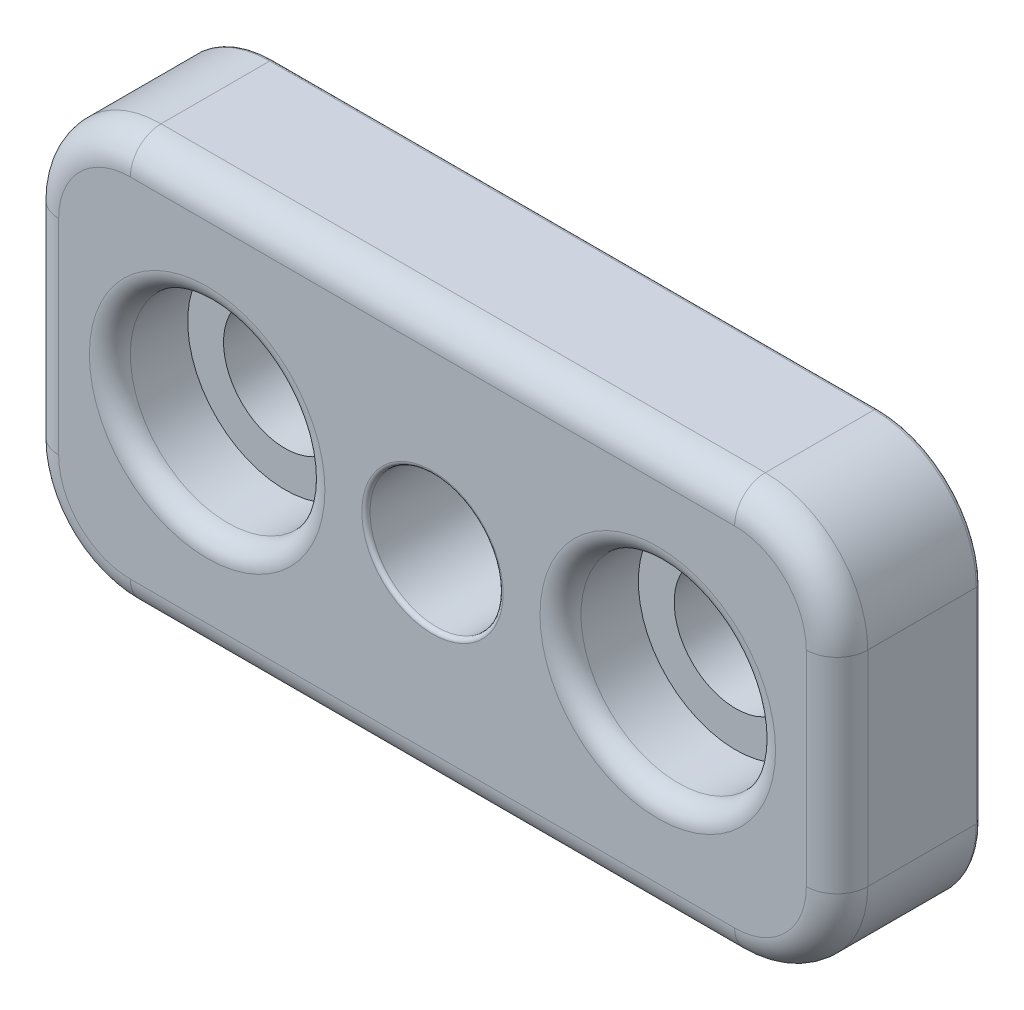
from build123d import *

# Parameters (mm, degrees)
SKETCH1_W           = 39.5
SKETCH1_H           = 20
SKETCH1_R           = 3.25
SKETCH1_R_2         = 4.75
SKETCH1_R_3         = 3
BOSS_EXTRUDE1_DEPTH = 3.5
CUT_EXTRUDE1_START  = -0.3
SKETCH1_3_R         = 4.75
SKETCH1_3_R_2       = 3
CUT_EXTRUDE1_DEPTH  = 3.8
FILLET1_R           = 5
FILLET2_R           = 1.5
FILLET3_R           = 1
FILLET4_R           = 0.2


with BuildPart() as part:
    # Sketch1 → Boss-Extrude1 (new, symmetric)
    # profile 1 of 3: a face of its own
    with BuildSketch(Plane.XY):
        Rectangle(SKETCH1_W, SKETCH1_H)
        Circle(SKETCH1_R, mode=Mode.SUBTRACT)
        with Locations((-11, 0)):
            Circle(SKETCH1_R_2, mode=Mode.SUBTRACT)
        with Locations((11, 0)):
            Circle(SKETCH1_R_2, mode=Mode.SUBTRACT)
    # profile 2 of 3: a face of its own
    with BuildSketch(Plane.XY):
        with Locations((-11, 0)):
            Circle(SKETCH1_R_2)
        with Locations((-11, 0)):
            Circle(SKETCH1_R_3, mode=Mode.SUBTRACT)
    # profile 3 of 3: a face of its own
    with BuildSketch(Plane.XY):
        with Locations((11, 0)):
            Circle(SKETCH1_R_2)
        with Locations((11, 0)):
            Circle(SKETCH1_R_3, mode=Mode.SUBTRACT)
    extrude(amount=BOSS_EXTRUDE1_DEPTH, both=True)

    # Sketch1<3> → Cut-Extrude1 (cut)
    # profile 1 of 2: a face of its own
    with BuildSketch(Plane.XY.offset(CUT_EXTRUDE1_START)):
        with Locations((-11, 0)):
            Circle(SKETCH1_3_R)
        with Locations((-11, 0)):
            Circle(SKETCH1_3_R_2, mode=Mode.SUBTRACT)
    # profile 2 of 2: a face of its own
    with BuildSketch(Plane.XY.offset(CUT_EXTRUDE1_START)):
        with Locations((11, 0)):
            Circle(SKETCH1_3_R)
        with Locations((11, 0)):
            Circle(SKETCH1_3_R_2, mode=Mode.SUBTRACT)
    extrude(amount=CUT_EXTRUDE1_DEPTH, mode=Mode.SUBTRACT)

    # Fillet1
    fillet1_edges = [part.edges().sort_by_distance(p)[0] for p in [
        (-19.75, 10, 0),
        (19.75, 10, 0),
        (19.75, -10, 0),
        (-19.75, -10, 0),
    ]]
    fillet(fillet1_edges, radius=FILLET1_R)

    # Fillet2
    fillet2_edges = [part.edges().sort_by_distance(p)[0] for p in [
        (0, 10, 3.5),
        (19.75, 0, 3.5),
        (-19.75, 0, 3.5),
        (0, -10, 3.5),
        (-18.285533906, 8.535533906, 3.5),
        (-18.285533906, -8.535533906, 3.5),
        (18.285533906, -8.535533906, 3.5),
        (18.285533906, 8.535533906, 3.5),
    ]]
    fillet(fillet2_edges, radius=FILLET2_R)

    # Fillet3
    fillet3_edges = [part.edges().sort_by_distance(p)[0] for p in [
        (-15.75, 0, 3.5),
        (6.25, 0, 3.5),
    ]]
    fillet(fillet3_edges, radius=FILLET3_R)

    # Fillet4
    fillet4_edges = [part.edges().sort_by_distance(p)[0] for p in [
        (-3.25, 0, -3.5),
        (-3.25, 0, 3.5),
        (0, 10, -3.5),
        (-19.75, 0, -3.5),
        (19.75, 0, -3.5),
        (0, -10, -3.5),
        (-18.285533906, 8.535533906, -3.5),
        (-18.285533906, -8.535533906, -3.5),
        (18.285533906, -8.535533906, -3.5),
        (18.285533906, 8.535533906, -3.5),
        (-14, 0, -3.5),
        (8, 0, -3.5),
    ]]
    fillet(fillet4_edges, radius=FILLET4_R)


solid = part.part
